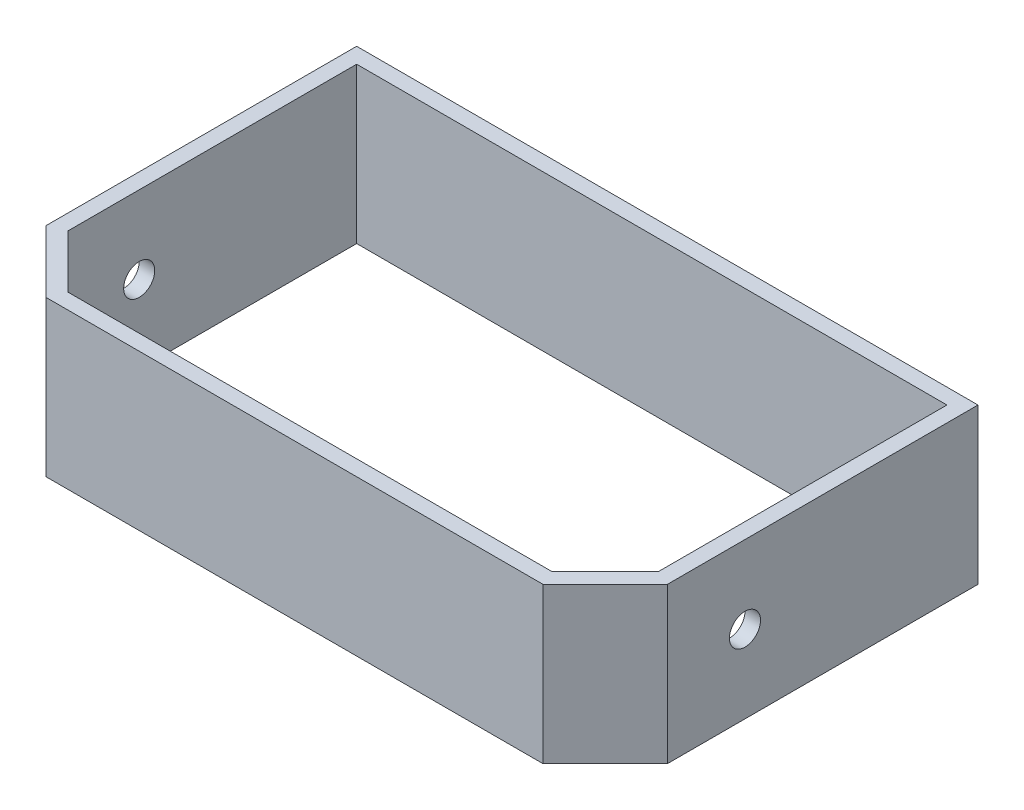
from build123d import *

# Parameters (mm, degrees)
BOSS_EXTRUDE1_DEPTH = 15.875
CUT_EXTRUDE1_REACH  = 150.955
SKETCH2_R           = 3.175
CUT_EXTRUDE2_REACH  = 150.955
SKETCH3_R           = 3.175


with BuildPart() as part:
    # Sketch1 → Boss-Extrude1 (new, symmetric)
    with BuildSketch(Plane(origin=(0, 0, 0), x_dir=(1, 0, 0), z_dir=(0, 1, 0))):
        Polygon((-50.8, 0), (50.8, 0), (63.5, 12.7), (63.5, 76.2), (-63.5, 76.2), (-63.5, 12.7), align=None)
        Polygon((60.325, 73.025), (-60.325, 73.025), (-60.325, 14.015128061), (-49.484871939, 3.175), (49.484871939, 3.175), (60.325, 14.015128061), align=None, mode=Mode.SUBTRACT)
    extrude(amount=BOSS_EXTRUDE1_DEPTH, both=True)

    # Sketch2 → Cut-Extrude1 (cut, up to next)
    with BuildSketch(Plane.ZY.offset(63.5), mode=Mode.PRIVATE) as cut_extrude1_sk1:
        with Locations((-28.575, 0)):
            Circle(SKETCH2_R)
    cut_extrude1_tool1 = extrude(cut_extrude1_sk1.sketch, amount=-CUT_EXTRUDE1_REACH, mode=Mode.PRIVATE) & part.part
    add(cut_extrude1_tool1.solids().sort_by_distance((-63.5, 0, -28.575))[0], mode=Mode.SUBTRACT)

    # Sketch3 → Cut-Extrude2 (cut, up to next)
    with BuildSketch(Plane(origin=(63.5, 0, 0), x_dir=(0, 0, -1), z_dir=(1, 0, 0)), mode=Mode.PRIVATE) as cut_extrude2_sk1:
        with Locations(Location((28.575, 0, 0), (0, 0, 180))):
            Circle(SKETCH3_R)
    cut_extrude2_tool1 = extrude(cut_extrude2_sk1.sketch, amount=-CUT_EXTRUDE2_REACH, mode=Mode.PRIVATE) & part.part
    add(cut_extrude2_tool1.solids().sort_by_distance((63.5, 0, -28.575))[0], mode=Mode.SUBTRACT)


solid = part.part
